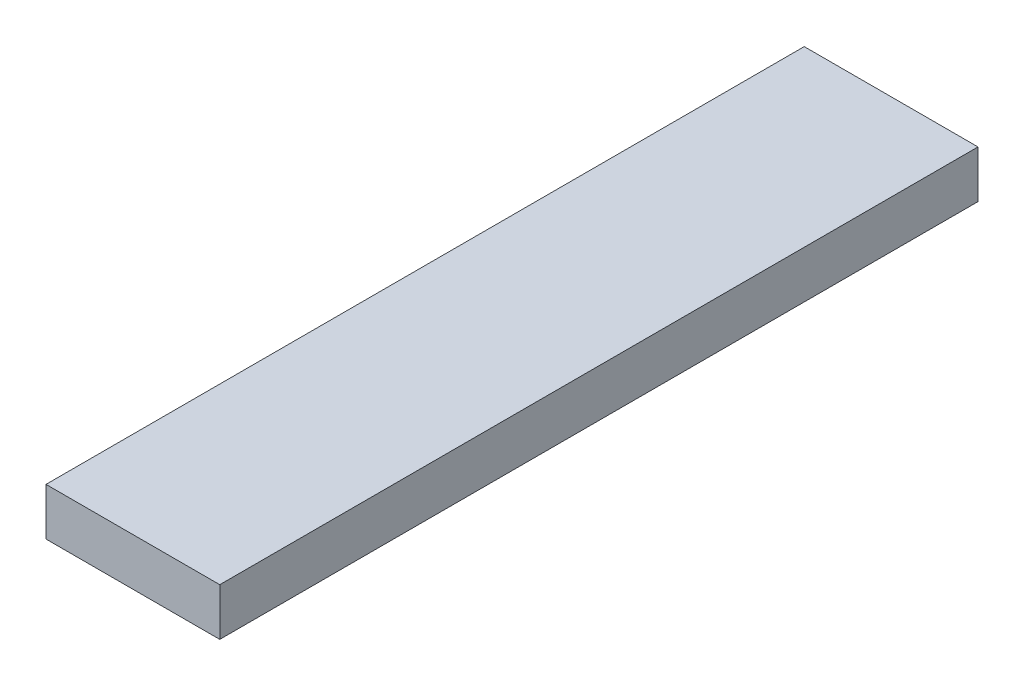
from build123d import *

# Parameters (mm, degrees)
BOSS_EXTRUDE1_DEPTH      = 304.8
BOSS_EXTRUDE1_DEPTH_BACK = 304.8
SKETCH1_W                = 139.7
SKETCH1_H                = 38.1


with BuildPart() as part:
    # Sketch1 → Boss-Extrude1 (new, two sides: drawn at the far end of the back side and taken through both)
    with BuildSketch(Plane.XY.offset(-BOSS_EXTRUDE1_DEPTH_BACK)):
        Rectangle(SKETCH1_W, SKETCH1_H)
    extrude(amount=BOSS_EXTRUDE1_DEPTH + BOSS_EXTRUDE1_DEPTH_BACK)


solid = part.part
